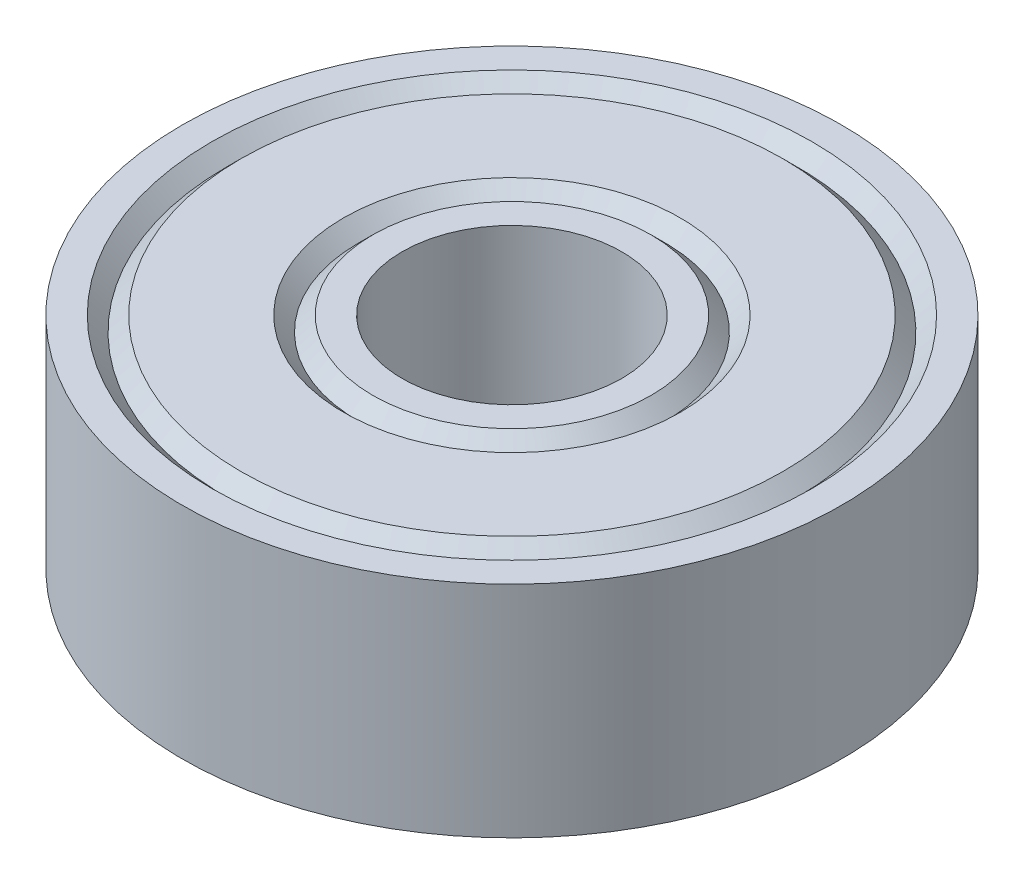
from build123d import *


with BuildPart() as part:
    # Sketch1 → Revolve1 (revolve)
    with BuildSketch(Plane.XY):
        Polygon((-2, 2), (-2.533333333, 2), (-2.8, 1.733333333), (-3.066666667, 2), (-4.933333333, 2), (-5.2, 1.733333333), (-5.466666667, 2), (-6, 2), (-6, -2), (-5.466666667, -2), (-5.2, -1.733333333), (-4.933333333, -2), (-3.066666667, -2), (-2.8, -1.733333333), (-2.533333333, -2), (-2, -2), align=None)
    revolve(axis=Axis((0, 2, 0), (0, -1, 0)))


solid = part.part
